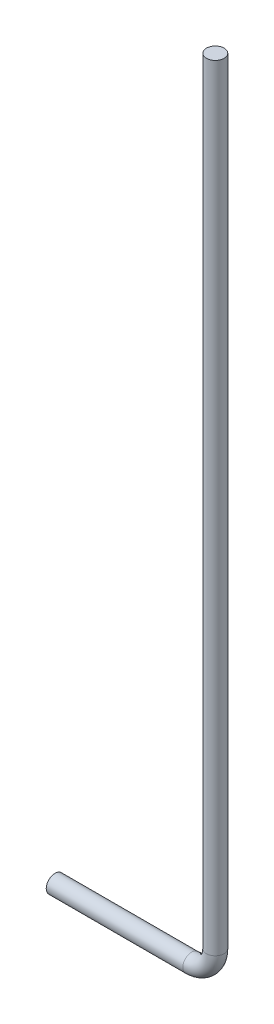
from build123d import *

# Parameters (mm, degrees)
SKETCH2_R = 4


with BuildPart() as part:
    # Sweep1: sweep along a path in Sketch1
    with BuildLine(Plane.XY) as sweep1_path:
        Line((0, 300), (0, -50.8))
        ThreePointArc((0, -50.8), (-3.138534005, -58.377091361), (-10.715625366, -61.515625366))
        Line((-10.715625366, -61.515625366), (-72.479048414, -61.515625366))
    # Sketch2 → Sweep1 (sweep)
    with BuildSketch(Plane(origin=(0, 300, 0), x_dir=(1, 0, 0), z_dir=(0, 1, 0))):
        Circle(SKETCH2_R)
    sweep(path=sweep1_path.line)


solid = part.part
